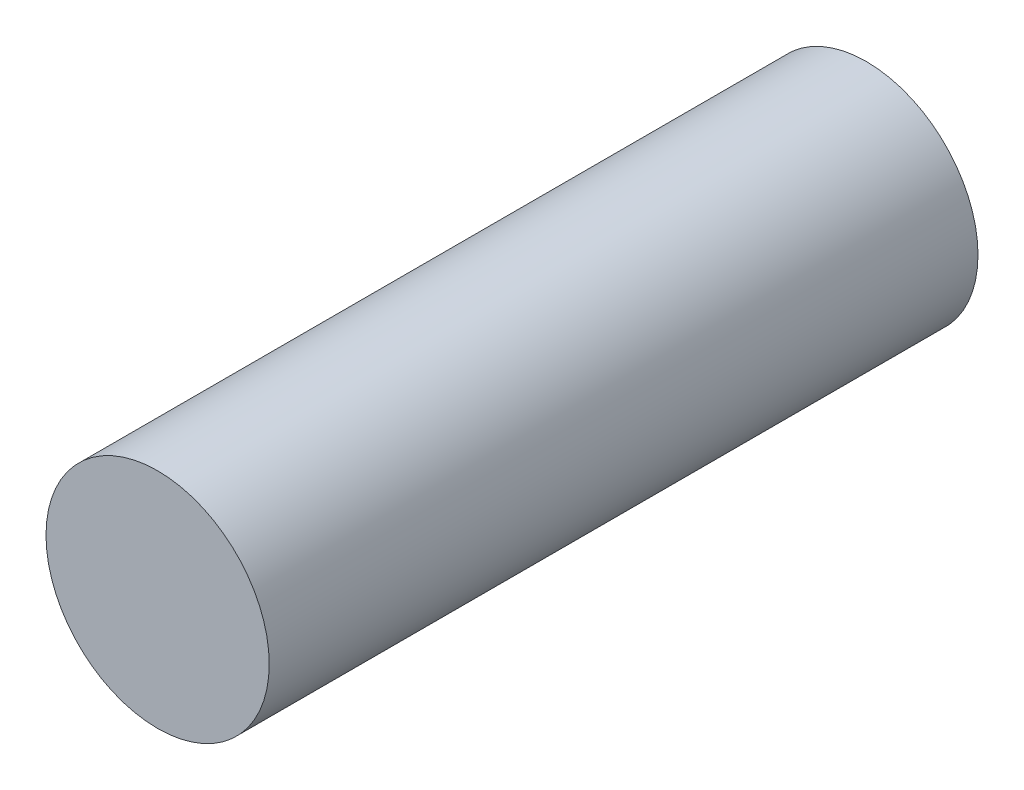
from build123d import *

# Parameters (mm, degrees)
SKETCH3_R           = 3
BOSS_EXTRUDE1_DEPTH = 9.525


with BuildPart() as part:
    # Sketch3 → Boss-Extrude1 (new, symmetric)
    with BuildSketch(Plane.XY):
        with Locations(Location((0, 0, 0), (0, 0, 180))):
            Circle(SKETCH3_R)
    extrude(amount=BOSS_EXTRUDE1_DEPTH, both=True)


solid = part.part
